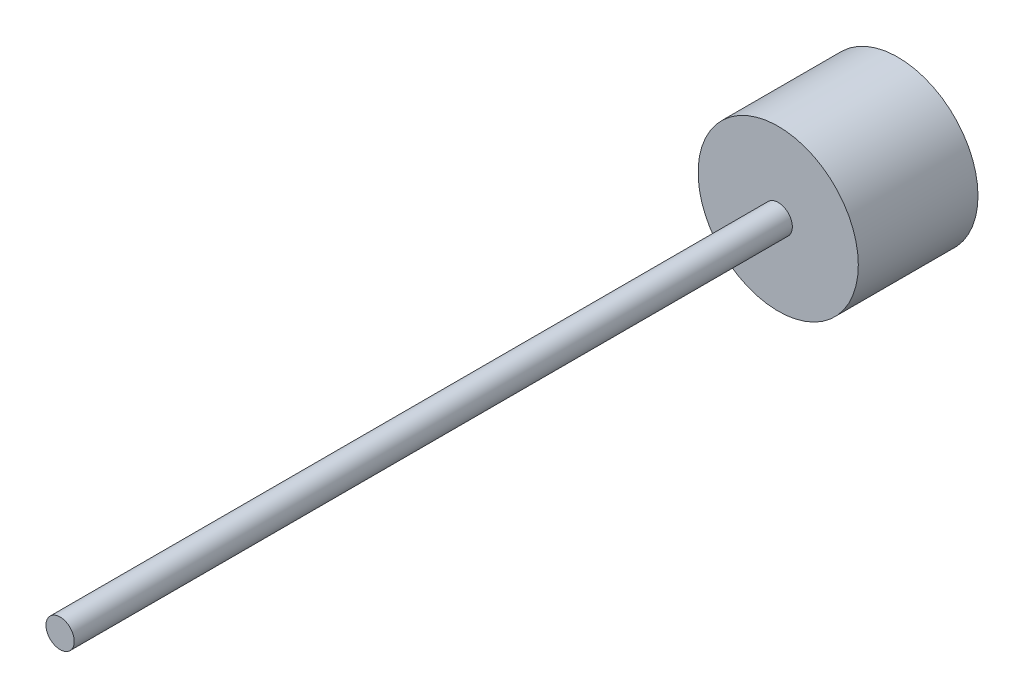
from build123d import *

# Parameters (mm, degrees)
SKETCH1_R           = 8.5
SKETCH1_R_2         = 1.499997
BOSS_EXTRUDE1_DEPTH = 12.7
SKETCH1_5_R         = 1.499997
BOSS_EXTRUDE2_DEPTH = 88.9


with BuildPart() as part:
    # Sketch1 → Boss-Extrude1 (new body)
    with BuildSketch(Plane.XY):
        Circle(SKETCH1_R)
        Circle(SKETCH1_R_2, mode=Mode.SUBTRACT)
    extrude(amount=BOSS_EXTRUDE1_DEPTH)

    # Sketch1<5> → Boss-Extrude2 (add)
    with BuildSketch(Plane.XY):
        Circle(SKETCH1_5_R)
    extrude(amount=BOSS_EXTRUDE2_DEPTH)


solid = part.part
